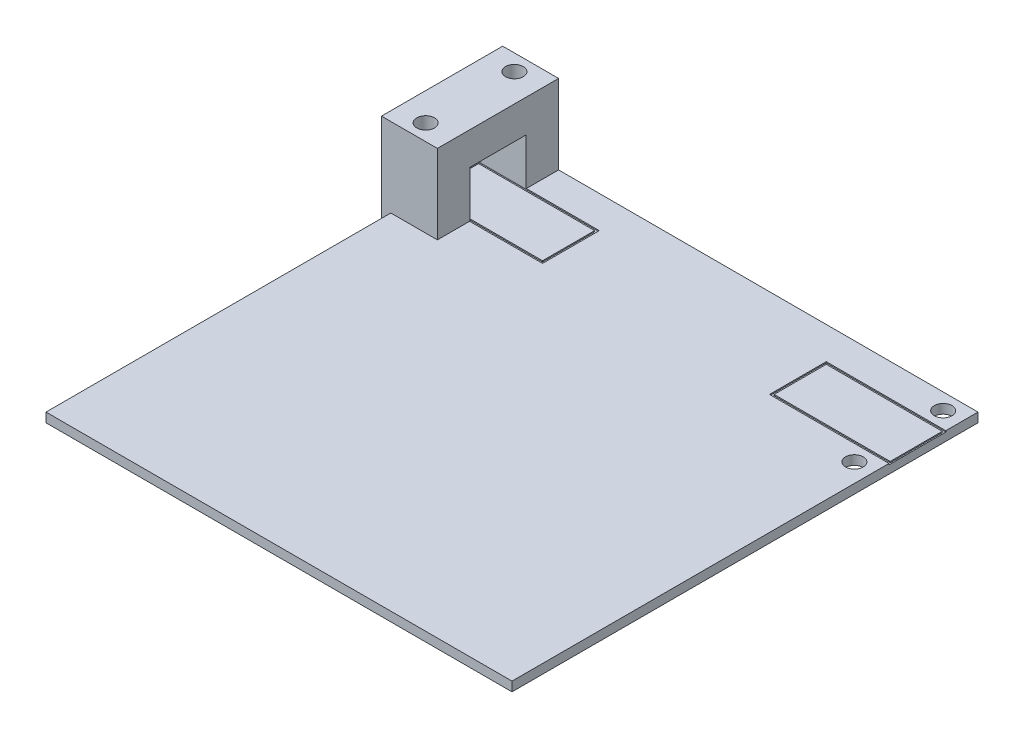
from build123d import *

# Parameters (mm, degrees)
SKETCH1_W             = 100
SKETCH1_H             = 100
BOSS_EXTRUDE1_DEPTH   = 2
F_6_CLEARANCE_HOLE1_D = 3.7973
SKETCH5_W             = 25.9
SKETCH5_H             = 12.184
SKETCH5_W_2           = 24.9
SKETCH5_H_2           = 11.184
CUT_EXTRUDE1_DEPTH    = 0.25
BOSS_EXTRUDE2_DEPTH   = 10
SKETCH9_R             = 1.89865
CUT_EXTRUDE2_DEPTH    = 73.726680283
SKETCH12_R            = 0.8
SKETCH12_R_2          = 2.509681558
BOSS_EXTRUDE3_DEPTH   = 2


with BuildPart() as part:
    # Sketch1 → Boss-Extrude1 (new body)
    with BuildSketch(Plane(origin=(0, 0, 0), x_dir=(1, 0, 0), z_dir=(0, 1, 0))):
        Rectangle(SKETCH1_W, SKETCH1_H)
    extrude(amount=BOSS_EXTRUDE1_DEPTH)

    # #6 Clearance Hole1 (through all)
    with Locations(Plane(origin=(0, 2, 0), x_dir=(1, 0, 0), z_dir=(0, 1, 0))):
        with Locations((-46, 27.47), (-46, 46.52)):
            f_6_clearance_hole1 = Hole(F_6_CLEARANCE_HOLE1_D / 2)

    # Sketch5 → Cut-Extrude1 (cut)
    with BuildSketch(Plane(origin=(0, 2, 0), x_dir=(1, 0, 0), z_dir=(0, 1, 0))):
        with Locations((-37.3, 36.995)):
            Rectangle(SKETCH5_W, SKETCH5_H)
        with Locations((-37.3, 36.995)):
            Rectangle(SKETCH5_W_2, SKETCH5_H_2, mode=Mode.SUBTRACT)
    cut_extrude1 = extrude(amount=-CUT_EXTRUDE1_DEPTH, mode=Mode.SUBTRACT)

    # Mirror1: #6 Clearance Hole1, Cut-Extrude1 across plane
    add(f_6_clearance_hole1.mirror(Plane(origin=(0, 0, 0), x_dir=(0, 0, 1), z_dir=(1, 0, 0))), mode=Mode.SUBTRACT)
    add(cut_extrude1.mirror(Plane(origin=(0, 0, 0), x_dir=(0, 0, 1), z_dir=(1, 0, 0))), mode=Mode.SUBTRACT)


with BuildPart() as body_2:
    # Sketch6 → Boss-Extrude2 (new body)
    with BuildSketch(Plane.ZY.offset(50)):
        Polygon((-30.995, 12), (-42.995, 12), (-42.995, 2), (-50, 2), (-50, 19.005), (-23.99, 19.005), (-23.99, 2), (-30.995, 2), align=None)
    extrude(amount=-BOSS_EXTRUDE2_DEPTH)

    # Sketch9 → Cut-Extrude2 (cut, through all)
    with BuildSketch(Plane.XZ.offset(-2)):
        with Locations(Location((-46, -27.47, 0), (0, 0, 270))):
            Circle(SKETCH9_R)
        with Locations(Location((-46, -46.52, 0), (0, 0, 270))):
            Circle(SKETCH9_R)
    extrude(amount=-CUT_EXTRUDE2_DEPTH, mode=Mode.SUBTRACT)

    # Sketch12 → Boss-Extrude3 (add)
    with BuildSketch(Plane.ZY.offset(50)):
        Polygon((-23.99, 2), (-23.99, 19.005), (-50, 19.005), (-50, 2), (-50, 0), (-23.99, 0), align=None)
        with Locations((-41.495, 7)):
            Circle(SKETCH12_R, mode=Mode.SUBTRACT)
        with Locations(Location((-32.495, 7, 0), (0, 0, 180))):
            Circle(SKETCH12_R, mode=Mode.SUBTRACT)
        with Locations((-36.995, 7)):
            Circle(SKETCH12_R_2, mode=Mode.SUBTRACT)
    extrude(amount=BOSS_EXTRUDE3_DEPTH)


solid = Compound([part.part, body_2.part])
